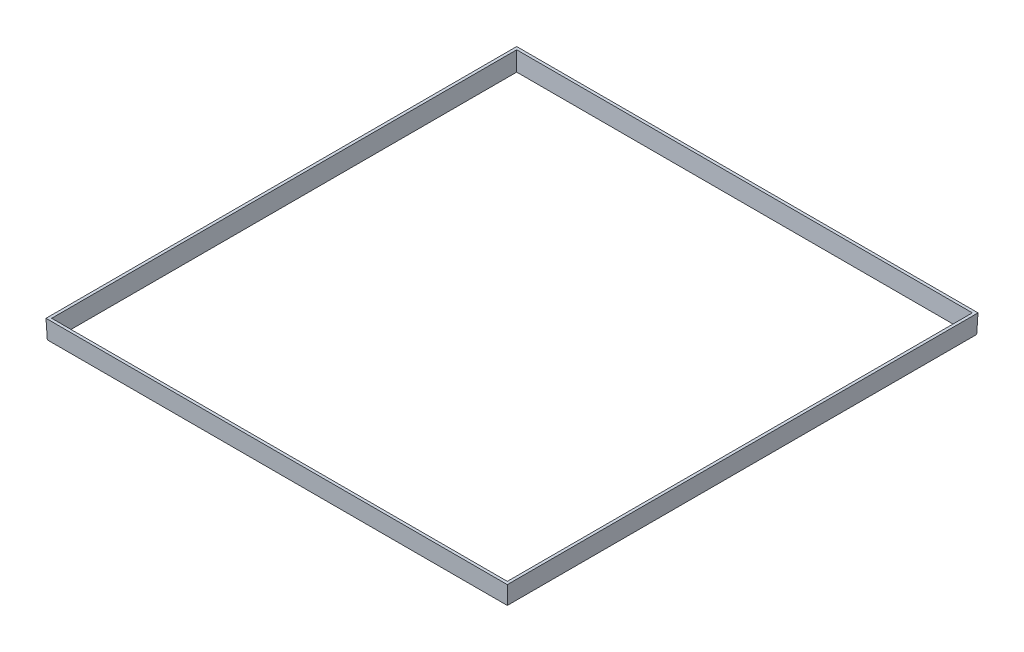
from build123d import *

# Parameters (mm, degrees)
SKETCH2_W           = 246
SKETCH2_H           = 251
BOSS_EXTRUDE1_DEPTH = 10
BOSS_EXTRUDE1_DRAFT = -2
SKETCH5_W           = 243
SKETCH5_H           = 248
CUT_EXTRUDE1_DEPTH  = 177.009232712
CUT_EXTRUDE1_DRAFT  = -2
CUT_EXTRUDE2_DEPTH  = 280.607703212


with BuildPart() as part:
    # Sketch2 → Boss-Extrude1 (with draft: the straight prism first)
    with BuildSketch(Plane(origin=(0, 0, 0), x_dir=(1, 0, 0), z_dir=(0, 1, 0))):
        Rectangle(SKETCH2_W, SKETCH2_H)
    extrude(amount=-BOSS_EXTRUDE1_DEPTH)
    # Boss-Extrude1: the draft: its side faces are tilted about the plane it starts from
    boss_extrude1_sides = [part.faces().sort_by_distance(p)[0] for p in [
        (0, -5, 125.5),
        (123, -5, 0),
        (0, -5, -125.5),
        (-123, -5, 0),
    ]]
    draft(boss_extrude1_sides, Plane(origin=(0, 0, 0), x_dir=(1, 0, 0), z_dir=(0, 1, 0)), BOSS_EXTRUDE1_DRAFT)


with BuildPart() as cut_extrude1_tool:
    # Sketch5 → Cut-Extrude1 (with draft: the straight prism first)
    with BuildSketch(Plane(origin=(0, 0, 0), x_dir=(1, 0, 0), z_dir=(0, 1, 0))):
        Rectangle(SKETCH5_W, SKETCH5_H)
    extrude(amount=-CUT_EXTRUDE1_DEPTH)
    # Cut-Extrude1: the draft: its side faces are tilted about the plane it starts from
    cut_extrude1_sides = [cut_extrude1_tool.faces().sort_by_distance(p)[0] for p in [
        (121.5, -88.504616356, 0),
        (0, -88.504616356, -124),
        (-121.5, -88.504616356, 0),
        (0, -88.504616356, 124),
    ]]
    draft(cut_extrude1_sides, Plane(origin=(0, 0, 0), x_dir=(1, 0, 0), z_dir=(0, 1, 0)), CUT_EXTRUDE1_DRAFT)


with BuildPart() as part_1:
    add(part.part)

    # Cut-Extrude1: cut by cut_extrude1_tool
    add(cut_extrude1_tool.part, mode=Mode.SUBTRACT)

    # Sketch9 → Cut-Extrude2 (cut, through all, along a direction that is not the sketch's normal)
    with BuildSketch(Plane(origin=(0, -4.377218727, 125.347144154), x_dir=(1, 0, 0), z_dir=(0, -0.03489949670250105, 0.9993908270190958))):
        Polygon((-122.651217373, -5.614028847), (-122.650792305, -5.626208607), (122.650792305, -5.626208607), (122.651217373, -5.614028847), align=None)
    extrude(amount=-CUT_EXTRUDE2_DEPTH, dir=(0, 0, 1), mode=Mode.SUBTRACT)


solid = part_1.part
